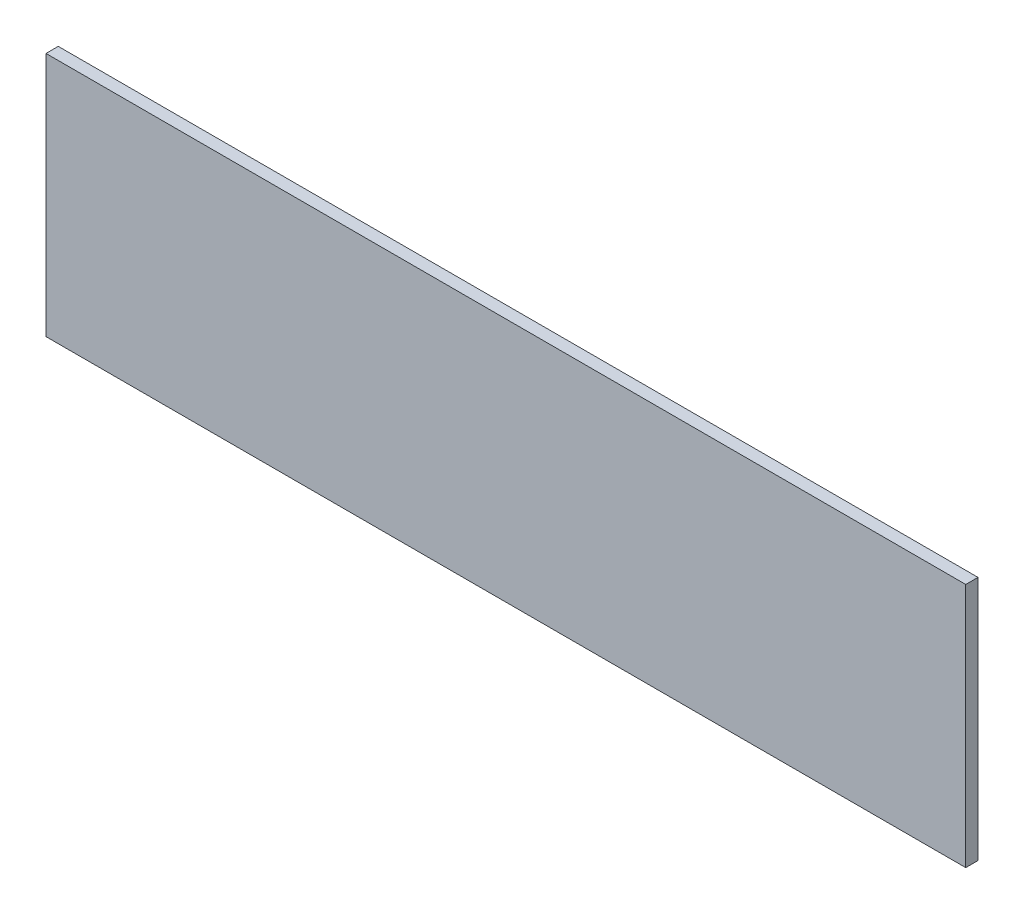
from build123d import *

# Parameters (mm, degrees)
CROQUIS1_W              = 300
CROQUIS1_H              = 80
SALIENTE_EXTRUIR1_DEPTH = 4


with BuildPart() as part:
    # Croquis1 → Saliente-Extruir1 (new body)
    with BuildSketch(Plane.XY):
        with Locations((150, 40)):
            Rectangle(CROQUIS1_W, CROQUIS1_H)
    extrude(amount=SALIENTE_EXTRUIR1_DEPTH)


solid = part.part
